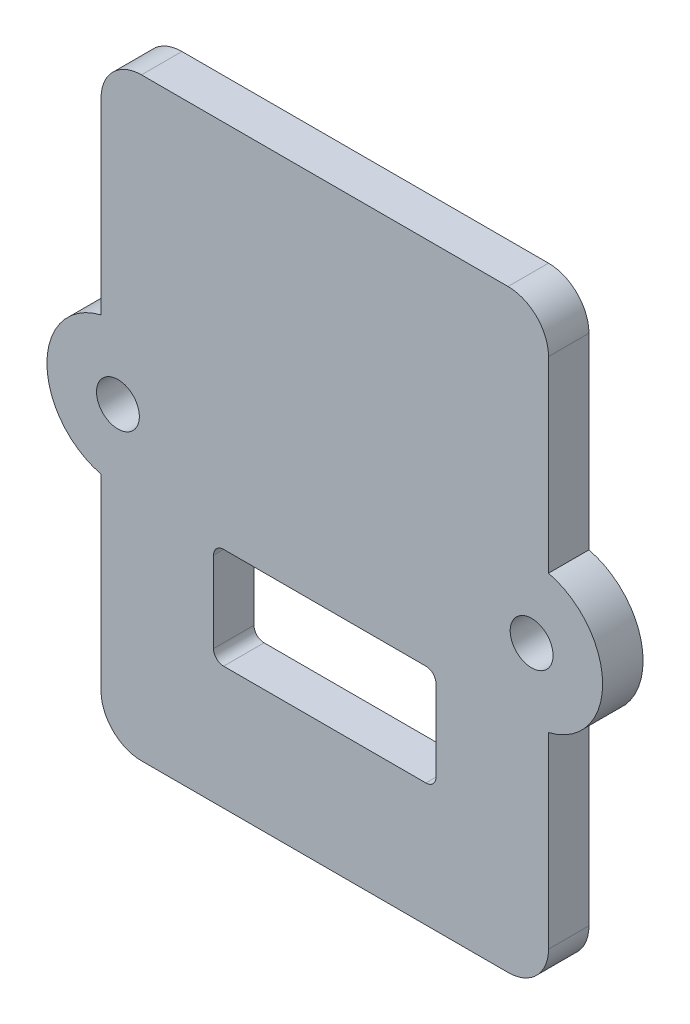
from build123d import *

# Parameters (mm, degrees)
SKETCH1_R           = 1.06
BOSS_EXTRUDE1_DEPTH = 2


with BuildPart() as part:
    # Sketch1 → Boss-Extrude1 (new body)
    with BuildSketch(Plane.XY):
        with BuildLine():
            Line((9.06, 28.183587826), (-9.06, 28.183587826))
            ThreePointArc((-9.06, 28.183587826), (-10.474213562, 27.597801388), (-11.06, 26.183587826))
            Line((-11.06, 26.183587826), (-11.06, 16.909233785))
            ThreePointArc((-11.06, 16.909233785), (-13.735, 13.5), (-11.06, 10.090766215))
            Line((-11.06, 10.090766215), (-11.06, 0.816412174))
            ThreePointArc((-11.06, 0.816412174), (-10.474213562, -0.597801388), (-9.06, -1.183587826))
            Line((-9.06, -1.183587826), (9.06, -1.183587826))
            ThreePointArc((9.06, -1.183587826), (10.474213562, -0.597801388), (11.06, 0.816412174))
            Line((11.06, 0.816412174), (11.06, 10.090766215))
            ThreePointArc((11.06, 10.090766215), (13.735, 13.5), (11.06, 16.909233785))
            Line((11.06, 16.909233785), (11.06, 26.183587826))
            ThreePointArc((11.06, 26.183587826), (10.474213562, 27.597801388), (9.06, 28.183587826))
        make_face()
        with Locations((-10.225, 13.5)):
            Circle(SKETCH1_R, mode=Mode.SUBTRACT)
        with BuildLine():
            Line((5, 4.9), (-5, 4.9))
            ThreePointArc((-5, 4.9), (-5.353553391, 5.046446609), (-5.5, 5.4))
            Line((-5.5, 5.4), (-5.5, 9.4))
            ThreePointArc((-5.5, 9.4), (-5.353553391, 9.753553391), (-5, 9.9))
            Line((-5, 9.9), (5, 9.9))
            ThreePointArc((5, 9.9), (5.353553391, 9.753553391), (5.5, 9.4))
            Line((5.5, 9.4), (5.5, 5.4))
            ThreePointArc((5.5, 5.4), (5.353553391, 5.046446609), (5, 4.9))
        make_face(mode=Mode.SUBTRACT)
        with Locations((10.225, 13.5)):
            Circle(SKETCH1_R, mode=Mode.SUBTRACT)
    extrude(amount=BOSS_EXTRUDE1_DEPTH)


solid = part.part
